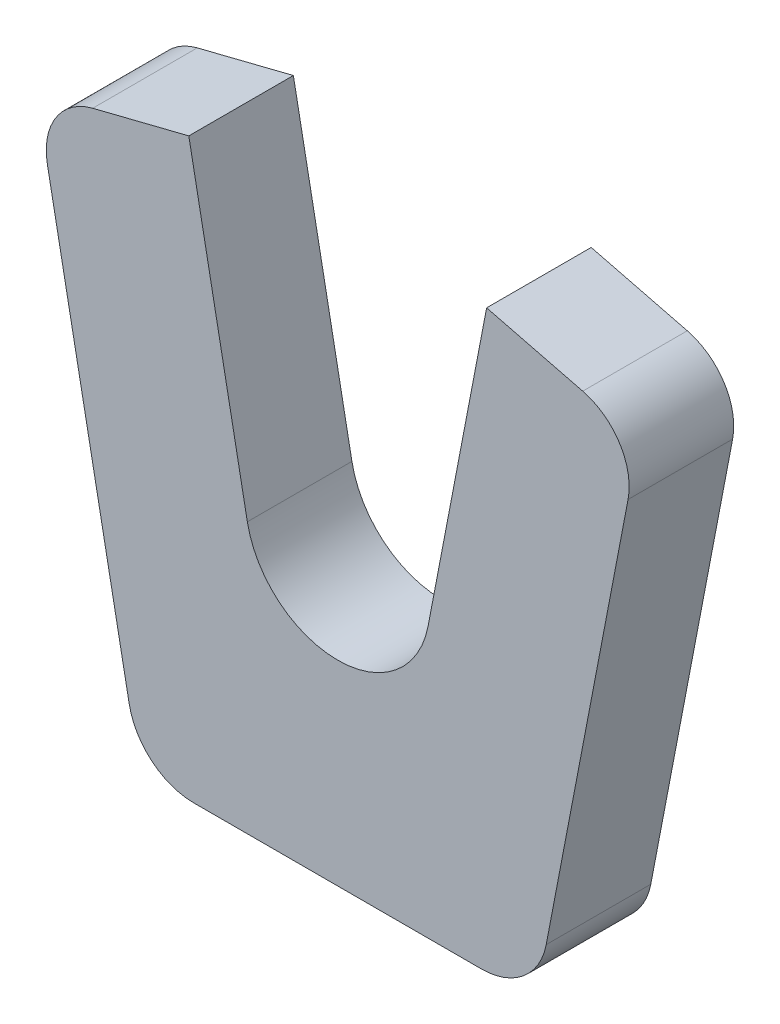
from build123d import *

# Parameters (mm, degrees)
SALIENTE_EXTRUIR1_DEPTH = 10


with BuildPart() as part:
    # Croquis1 → Saliente-Extruir1 (new body)
    with BuildSketch(Plane.XY):
        with BuildLine():
            Line((-13.75, 0), (13.75, 0))
            ThreePointArc((13.75, 0), (17.762966925, 1.443448089), (19.937041964, 5.11235033))
            Line((19.937041964, 5.11235033), (27.765257697, 45.893315022))
            ThreePointArc((27.765257697, 45.893315022), (26.949859086, 50.156238741), (23.428875228, 52.693967294))
            Line((23.428875228, 52.693967294), (14.23949707, 55))
            Line((14.23949707, 55), (8.642217346, 25.841060779))
            ThreePointArc((8.642217346, 25.841060779), (0, 18.7), (-8.642217346, 25.841060779))
            Line((-8.642217346, 25.841060779), (-14.23949707, 55))
            Line((-14.23949707, 55), (-23.428875228, 52.693967294))
            ThreePointArc((-23.428875228, 52.693967294), (-26.949859086, 50.156238741), (-27.765257697, 45.893315022))
            Line((-27.765257697, 45.893315022), (-19.937041964, 5.11235033))
            ThreePointArc((-19.937041964, 5.11235033), (-17.762966925, 1.443448089), (-13.75, 0))
        make_face()
    extrude(amount=SALIENTE_EXTRUIR1_DEPTH)


solid = part.part
